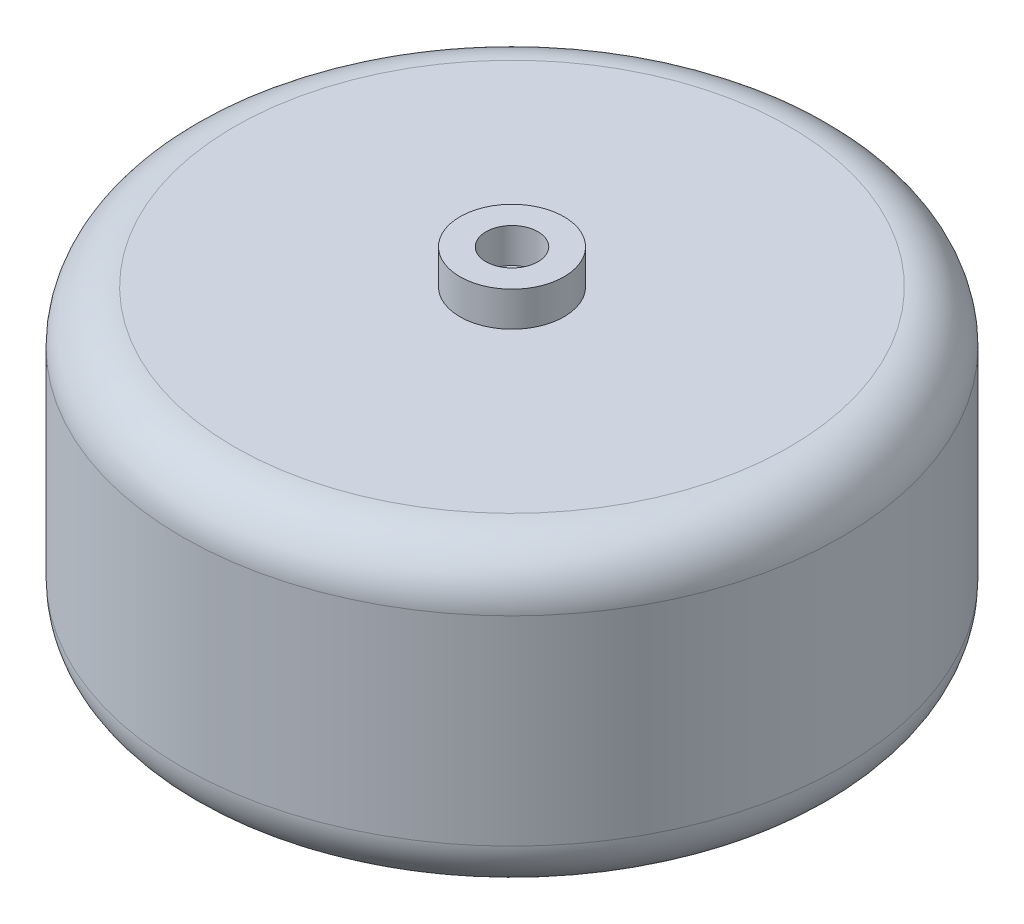
from build123d import *

# Parameters (mm, degrees)
SKETCH_1_R      = 38
EXTRUDE_1_DEPTH = 17.5
SKETCH_2_R      = 6
SKETCH_2_R_2    = 3
EXTRUDE_2_DEPTH = 4
FILLET_1_R      = 6


with BuildPart() as part:
    # 草图1 → 凸台-拉伸1 (new, symmetric)
    with BuildSketch(Plane(origin=(0, 0, 0), x_dir=(1, 0, 0), z_dir=(0, 1, 0))):
        with Locations(Location((0, 0, 0), (0, 0, 270))):
            Circle(SKETCH_1_R)
    extrude(amount=EXTRUDE_1_DEPTH, both=True)

    # 草图2 → 凸台-拉伸2 (add)
    with BuildSketch(Plane(origin=(0, 17.5, 0), x_dir=(1, 0, 0), z_dir=(0, 1, 0))):
        with Locations(Location((0, 0, 0), (0, 0, 270))):
            Circle(SKETCH_2_R)
        with Locations(Location((0, 0, 0), (0, 0, 270))):
            Circle(SKETCH_2_R_2, mode=Mode.SUBTRACT)
    extrude(amount=EXTRUDE_2_DEPTH)

    # 圆角1
    fillet_1_edges = [part.edges().sort_by_distance(p)[0] for p in [
        (0, -17.5, -38),
        (0, 17.5, -38),
    ]]
    fillet(fillet_1_edges, radius=FILLET_1_R)


solid = part.part
